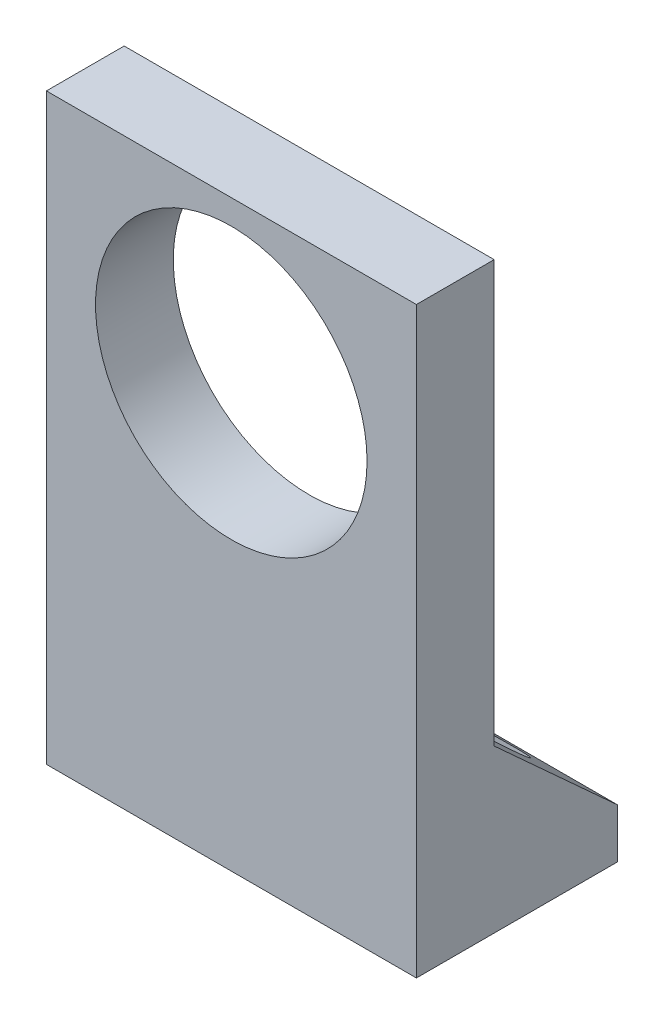
from build123d import *

# Parameters (mm, degrees)
SKETCH1_W            = 93
SKETCH1_H            = 100
BOSS_EXTRUDE2_DEPTH  = 10
SKETCH4_W            = 10.01
SKETCH4_H            = 15
BOSS_EXTRUDE4_DEPTH  = 24
SKETCH5_R            = 2
CUT_EXTRUDE1_DEPTH   = 50
SKETCH7_R            = 11
CUT_EXTRUDE3_DEPTH   = 50
SKETCH14_W           = 61.5
SKETCH14_H           = 42
CUT_EXTRUDE8_DEPTH   = 4
SKETCH19_R           = 11
CUT_EXTRUDE11_DEPTH  = 15
SKETCH20_R           = 2
CUT_EXTRUDE12_DEPTH  = 10
SKETCH21_W           = 40
SKETCH21_H           = 6
BOSS_EXTRUDE5_DEPTH  = 27
SKETCH22_W           = 40
SKETCH22_H           = 6.3
BOSS_EXTRUDE7_DEPTH  = 40
SKETCH23_R           = 8
CUT_EXTRUDE13_DEPTH  = 40
SKETCH24_W           = 118.277817783
SKETCH24_H           = 41.8
CUT_EXTRUDE14_DEPTH  = 40
SKETCH25_W           = 31.5
SKETCH25_H           = 23.2
CUT_EXTRUDE15_DEPTH  = 20
CUT_EXTRUDE18_DEPTH  = 3
SKETCH27_R           = 4.1
SKETCH27_R_2         = 4
CUT_EXTRUDE29_DEPTH  = 3
SKETCH28_W           = 29.5
SKETCH28_H           = 58.2
CUT_EXTRUDE30_DEPTH  = 23
SKETCH29_W           = 32
SKETCH29_H           = 4
CUT_EXTRUDE31_DEPTH  = 23
SKETCH31_W           = 32
SKETCH31_H           = 6
BOSS_EXTRUDE9_DEPTH  = 6.6
SKETCH32_W           = 32
SKETCH32_H           = 6
BOSS_EXTRUDE10_DEPTH = 10
SKETCH33_R           = 2
CUT_EXTRUDE32_DEPTH  = 10
BOSS_EXTRUDE11_START = -32
BOSS_EXTRUDE11_DEPTH = 32
SKETCH35_R           = 3.5
CUT_EXTRUDE33_DEPTH  = 10
SKETCH36_W           = 40
SKETCH36_H           = 6.3
BOSS_EXTRUDE12_DEPTH = 18.8
SKETCH37_W           = 40
SKETCH37_H           = 6
BOSS_EXTRUDE13_DEPTH = 16
SKETCH38_R           = 2
CUT_EXTRUDE34_DEPTH  = 16
BOSS_EXTRUDE14_DEPTH = 40
SKETCH40_R           = 3.5
CUT_EXTRUDE35_DEPTH  = 16
SKETCH41_W           = 16
SKETCH41_H           = 64.8
CUT_EXTRUDE36_DEPTH  = 76
SKETCH42_W           = 20.7
SKETCH42_H           = 6
CUT_EXTRUDE37_DEPTH  = 76
SKETCH43_W           = 10.32098901
SKETCH43_H           = 73.075116481
CUT_EXTRUDE38_DEPTH  = 30
SKETCH44_W           = 2
SKETCH44_H           = 70.783229749
CUT_EXTRUDE39_DEPTH  = 30
SKETCH45_W           = 27.67901099
SKETCH45_H           = 15
CUT_EXTRUDE40_DEPTH  = 30
SKETCH46_W           = 27.67901099
SKETCH46_H           = 2.54
CUT_EXTRUDE41_DEPTH  = 110
SKETCH47_R           = 11
CUT_EXTRUDE42_DEPTH  = 20
BOSS_EXTRUDE16_DEPTH = 2.3
CUT_EXTRUDE43_DEPTH  = 50
SKETCH51_W           = 29.97901099
SKETCH51_H           = 4
BOSS_EXTRUDE17_DEPTH = 10
SKETCH52_R           = 2
CUT_EXTRUDE44_DEPTH  = 10
BOSS_EXTRUDE18_DEPTH = 29.979011
SKETCH54_R           = 3.5
CUT_EXTRUDE45_DEPTH  = 10


with BuildPart() as part:
    # Sketch1 → Boss-Extrude2 (new body)
    with BuildSketch(Plane.XY):
        with Locations((-29.68705036, 14.928057554)):
            Rectangle(SKETCH1_W, SKETCH1_H)
    extrude(amount=BOSS_EXTRUDE2_DEPTH)

    # Sketch4 → Boss-Extrude4 (add)
    with BuildSketch(Plane(origin=(16.81294964, 0, 0), x_dir=(0, 0, -1), z_dir=(1, 0, 0))):
        with Locations((-4.995, -12.571942446)):
            Rectangle(SKETCH4_W, SKETCH4_H)
    extrude(amount=BOSS_EXTRUDE4_DEPTH)

    # Sketch5 → Cut-Extrude1 (cut)
    with BuildSketch(Plane(origin=(0, -5.071942446, 0), x_dir=(1, 0, 0), z_dir=(0, 1, 0))):
        with Locations(Location((26.81294964, -5, 0), (0, 0, 180))):
            Circle(SKETCH5_R)
    extrude(amount=-CUT_EXTRUDE1_DEPTH, mode=Mode.SUBTRACT)

    # Sketch7 → Cut-Extrude3 (cut)
    with BuildSketch(Plane(origin=(0, 0, 0), x_dir=(-1, 0, 0), z_dir=(0, 0, -1))):
        with Locations((24.18705036, 36.928057554)):
            Circle(SKETCH7_R)
    extrude(amount=-CUT_EXTRUDE3_DEPTH, mode=Mode.SUBTRACT)

    # Sketch14 → Cut-Extrude8 (cut)
    with BuildSketch(Plane.XY.offset(10)):
        with Locations((-13.93705036, 36.789132279)):
            Rectangle(SKETCH14_W, SKETCH14_H)
    extrude(amount=-CUT_EXTRUDE8_DEPTH, mode=Mode.SUBTRACT)

    # Sketch19 → Cut-Extrude11 (cut)
    with BuildSketch(Plane(origin=(0, 0, 0), x_dir=(-1, 0, 0), z_dir=(0, 0, -1))):
        with Locations((53.18705036, 36.928057554)):
            Circle(SKETCH19_R)
    extrude(amount=-CUT_EXTRUDE11_DEPTH, mode=Mode.SUBTRACT)

    # Sketch20 → Cut-Extrude12 (cut)
    with BuildSketch(Plane.XY.offset(6)):
        with Locations((-34.68705036, 50.928057554)):
            Circle(SKETCH20_R)
        with Locations((5.31294964, 50.928057554)):
            Circle(SKETCH20_R)
        with Locations((-34.68705036, 22.928057554)):
            Circle(SKETCH20_R)
        with Locations((5.31294964, 22.928057554)):
            Circle(SKETCH20_R)
    extrude(amount=-CUT_EXTRUDE12_DEPTH, mode=Mode.SUBTRACT)

    # Sketch21 → Boss-Extrude5 (add)
    with BuildSketch(Plane(origin=(0, 0, 0), x_dir=(-1, 0, 0), z_dir=(0, 0, -1))):
        with Locations((56.18705036, 61.928057554)):
            Rectangle(SKETCH21_W, SKETCH21_H)
    extrude(amount=BOSS_EXTRUDE5_DEPTH)

    # Sketch22 → Boss-Extrude7 (add)
    with BuildSketch(Plane.XZ.offset(-58.928057554)):
        with Locations((-56.18705036, -23.85)):
            Rectangle(SKETCH22_W, SKETCH22_H)
    extrude(amount=BOSS_EXTRUDE7_DEPTH)

    # Sketch23 → Cut-Extrude13 (cut)
    with BuildSketch(Plane.XY.offset(10)):
        with Locations((-53.18705036, 36.928057554)):
            Circle(SKETCH23_R)
    extrude(amount=-CUT_EXTRUDE13_DEPTH, mode=Mode.SUBTRACT)

    # Sketch24 → Cut-Extrude14 (cut)
    with BuildSketch(Plane.XY.offset(10)):
        with Locations((-17.048141468, -14.171942446)):
            Rectangle(SKETCH24_W, SKETCH24_H)
    extrude(amount=-CUT_EXTRUDE14_DEPTH, mode=Mode.SUBTRACT)

    # Sketch25 → Cut-Extrude15 (cut)
    with BuildSketch(Plane.XY.offset(10)):
        with Locations((-60.43705036, 18.328057554)):
            Rectangle(SKETCH25_W, SKETCH25_H)
    extrude(amount=-CUT_EXTRUDE15_DEPTH, mode=Mode.SUBTRACT)

    # Sketch26 → Cut-Extrude18 (cut)
    with BuildSketch(Plane.XY.offset(6)):
        with BuildLine():
            Line((14.30212304, 57.789132279), (6.863398886, 57.789132279))
            Line((6.863398886, 57.789132279), (6.863398886, 54.615347499))
            ThreePointArc((6.863398886, 54.615347499), (8.24773413, 53.645968516), (9.108195728, 52.191428892))
            Line((9.108195728, 52.191428892), (14.30212304, 52.191428892))
            Line((14.30212304, 52.191428892), (14.30212304, 57.789132279))
        make_face()
        with BuildLine():
            Line((6.863398886, 19.240767609), (6.863398886, 15.789132279))
            Line((6.863398886, 15.789132279), (14.30212304, 15.789132279))
            Line((14.30212304, 15.789132279), (14.30212304, 20.928057554))
            Line((14.30212304, 20.928057554), (8.777051255, 20.928057554))
            ThreePointArc((8.777051255, 20.928057554), (7.95835451, 19.927752057), (6.863398886, 19.240767609))
        make_face()
        with BuildLine():
            Line((-36.237499605, 57.789132279), (-44.68705036, 57.789132279))
            Line((-44.68705036, 57.789132279), (-44.68705036, 52.191428892))
            Line((-44.68705036, 52.191428892), (-38.482296447, 52.191428892))
            ThreePointArc((-38.482296447, 52.191428892), (-37.621834849, 53.645968516), (-36.237499605, 54.615347499))
            Line((-36.237499605, 54.615347499), (-36.237499605, 57.789132279))
        make_face()
        with BuildLine():
            Line((-44.68705036, 21.664686216), (-44.68705036, 15.789132279))
            Line((-44.68705036, 15.789132279), (-36.237499605, 15.789132279))
            Line((-36.237499605, 15.789132279), (-36.237499605, 19.240767609))
            ThreePointArc((-36.237499605, 19.240767609), (-37.621834849, 20.210146592), (-38.482296447, 21.664686216))
            Line((-38.482296447, 21.664686216), (-44.68705036, 21.664686216))
        make_face()
    extrude(amount=-CUT_EXTRUDE18_DEPTH, mode=Mode.SUBTRACT)

    # Sketch27 → Cut-Extrude29 (cut)
    with BuildSketch(Plane.XY.offset(6)):
        with Locations((5.31294964, 50.928057554)):
            Circle(SKETCH27_R)
        with Locations((5.31294964, 22.928057554)):
            Circle(SKETCH27_R_2)
        with Locations((-34.68705036, 50.928057554)):
            Circle(SKETCH27_R)
        with Locations((-34.68705036, 22.928057554)):
            Circle(SKETCH27_R)
    extrude(amount=-CUT_EXTRUDE29_DEPTH, mode=Mode.SUBTRACT)

    # Sketch28 → Cut-Extrude30 (cut)
    with BuildSketch(Plane(origin=(0, 0, 0), x_dir=(-1, 0, 0), z_dir=(0, 0, -1))):
        with Locations((-2.06294964, 35.828057554)):
            Rectangle(SKETCH28_W, SKETCH28_H)
    extrude(amount=-CUT_EXTRUDE30_DEPTH, mode=Mode.SUBTRACT)

    # Sketch29 → Cut-Extrude31 (cut)
    with BuildSketch(Plane(origin=(0, 15.789132279, 0), x_dir=(1, 0, 0), z_dir=(0, 1, 0))):
        with Locations((-28.68705036, -8)):
            Rectangle(SKETCH29_W, SKETCH29_H)
    extrude(amount=-CUT_EXTRUDE31_DEPTH, mode=Mode.SUBTRACT)

    # Sketch31 → Boss-Extrude9 (add)
    with BuildSketch(Plane.XZ.offset(-6.728057554)):
        with Locations((-28.68705036, 3)):
            Rectangle(SKETCH31_W, SKETCH31_H)
    extrude(amount=BOSS_EXTRUDE9_DEPTH)

    # Sketch32 → Boss-Extrude10 (add)
    with BuildSketch(Plane.XY.offset(6)):
        with Locations((-28.68705036, 3.128057554)):
            Rectangle(SKETCH32_W, SKETCH32_H)
    extrude(amount=BOSS_EXTRUDE10_DEPTH)

    # Sketch33 → Cut-Extrude32 (cut)
    with BuildSketch(Plane(origin=(0, 6.128057554, 0), x_dir=(1, 0, 0), z_dir=(0, 1, 0))):
        with Locations(Location((-37.68705036, -11, 0), (0, 0, 270))):
            Circle(SKETCH33_R)
        with Locations(Location((-19.68705036, -11, 0), (0, 0, 270))):
            Circle(SKETCH33_R)
    extrude(amount=-CUT_EXTRUDE32_DEPTH, mode=Mode.SUBTRACT)

    # Sketch34 → Boss-Extrude11 (add)
    with BuildSketch(Plane(origin=(-12.68705036, 0, 0), x_dir=(0, 0, -1), z_dir=(1, 0, 0)).offset(BOSS_EXTRUDE11_START)):
        Polygon((-16, 6.128057554), (-6, 6.128057554), (-6, 14.058360342), align=None)
    extrude(amount=BOSS_EXTRUDE11_DEPTH)

    # Sketch35 → Cut-Extrude33 (cut)
    with BuildSketch(Plane.XZ.offset(-6.128057554)):
        with Locations((-19.68705036, 11)):
            Circle(SKETCH35_R)
        with Locations((-37.68705036, 11)):
            Circle(SKETCH35_R)
    extrude(amount=-CUT_EXTRUDE33_DEPTH, mode=Mode.SUBTRACT)

    # Sketch36 → Boss-Extrude12 (add)
    with BuildSketch(Plane.XZ.offset(-18.928057554)):
        with Locations((-56.18705036, -23.85)):
            Rectangle(SKETCH36_W, SKETCH36_H)
    extrude(amount=BOSS_EXTRUDE12_DEPTH)

    # Sketch37 → Boss-Extrude13 (add)
    with BuildSketch(Plane.XY.offset(-20.7)):
        with Locations((-56.18705036, 3.128057554)):
            Rectangle(SKETCH37_W, SKETCH37_H)
    extrude(amount=BOSS_EXTRUDE13_DEPTH)

    # Sketch38 → Cut-Extrude34 (cut)
    with BuildSketch(Plane(origin=(0, 6.128057554, 0), x_dir=(1, 0, 0), z_dir=(0, 1, 0))):
        with Locations(Location((-58.18705036, 10.7, 0), (0, 0, 180))):
            Circle(SKETCH38_R)
        with Locations(Location((-45.18705036, 10.7, 0), (0, 0, 180))):
            Circle(SKETCH38_R)
    extrude(amount=-CUT_EXTRUDE34_DEPTH, mode=Mode.SUBTRACT)

    # Sketch39 → Boss-Extrude14 (add)
    with BuildSketch(Plane(origin=(-36.18705036, 0, 0), x_dir=(0, 0, -1), z_dir=(1, 0, 0))):
        Polygon((4.7, 6.128057554), (20.7, 18.878141719), (20.7, 6.128057554), align=None)
    extrude(amount=-BOSS_EXTRUDE14_DEPTH)

    # Sketch40 → Cut-Extrude35 (cut)
    with BuildSketch(Plane.XZ.offset(-6.128057554)):
        with Locations(Location((-45.18705036, -10.7, 0), (0, 0, 270))):
            Circle(SKETCH40_R)
        with Locations(Location((-58.18705036, -10.7, 0), (0, 0, 270))):
            Circle(SKETCH40_R)
    extrude(amount=-CUT_EXTRUDE35_DEPTH, mode=Mode.SUBTRACT)

    # Sketch41 → Cut-Extrude36 (cut)
    with BuildSketch(Plane(origin=(-12.68705036, 0, 0), x_dir=(0, 0, -1), z_dir=(1, 0, 0))):
        with Locations((-8, 32.528057554)):
            Rectangle(SKETCH41_W, SKETCH41_H)
    extrude(amount=-CUT_EXTRUDE36_DEPTH, mode=Mode.SUBTRACT)

    # Sketch42 → Cut-Extrude37 (cut)
    with BuildSketch(Plane(origin=(-36.18705036, 0, 0), x_dir=(0, 0, -1), z_dir=(1, 0, 0))):
        with Locations((10.35, 61.928057554)):
            Rectangle(SKETCH42_W, SKETCH42_H)
    extrude(amount=-CUT_EXTRUDE37_DEPTH, mode=Mode.SUBTRACT)

    # Sketch43 → Cut-Extrude38 (cut)
    with BuildSketch(Plane.XY.offset(-4.7)):
        with Locations((-71.026555855, 36.665615794)):
            Rectangle(SKETCH43_W, SKETCH43_H)
    extrude(amount=-CUT_EXTRUDE38_DEPTH, mode=Mode.SUBTRACT)

    # Sketch44 → Cut-Extrude39 (cut)
    with BuildSketch(Plane.XY.offset(-4.7)):
        with Locations((-37.18705036, 35.519672429)):
            Rectangle(SKETCH44_W, SKETCH44_H)
    extrude(amount=-CUT_EXTRUDE39_DEPTH, mode=Mode.SUBTRACT)

    # Sketch45 → Cut-Extrude40 (cut)
    with BuildSketch(Plane.XY.offset(-20.7)):
        with Locations((-52.026555855, 57.428057554)):
            Rectangle(SKETCH45_W, SKETCH45_H)
    extrude(amount=-CUT_EXTRUDE40_DEPTH, mode=Mode.SUBTRACT)

    # Sketch46 → Cut-Extrude41 (cut)
    with BuildSketch(Plane.XY.offset(-4.7)):
        with Locations((-52.026555855, 1.398057554)):
            Rectangle(SKETCH46_W, SKETCH46_H)
    extrude(amount=-CUT_EXTRUDE41_DEPTH, mode=Mode.SUBTRACT)

    # Sketch47 → Cut-Extrude42 (cut)
    with BuildSketch(Plane.XY.offset(-20.7)):
        with Locations((-53.18705036, 36.928057554)):
            Circle(SKETCH47_R)
    extrude(amount=-CUT_EXTRUDE42_DEPTH, mode=Mode.SUBTRACT)

    # Sketch48 → Boss-Extrude16 (add)
    with BuildSketch(Plane.ZY.offset(65.86606135)):
        Polygon((-27, 49.928057554), (-20.7, 49.928057554), (-20.7, 18.878141719), (-4.7, 6.128057554), (-4.7, 2.668057554), (-27, 2.668057554), align=None)
    extrude(amount=BOSS_EXTRUDE16_DEPTH)

    # Sketch49 → Cut-Extrude43 (cut)
    with BuildSketch(Plane.ZY.offset(68.16606135)):
        Polygon((-4.7, 2.668057554), (-4.7, 6.128057554), (-20.7, 18.878141719), (-20.7, 2.668057554), align=None)
    extrude(amount=-CUT_EXTRUDE43_DEPTH, mode=Mode.SUBTRACT)

    # Sketch51 → Boss-Extrude17 (add)
    with BuildSketch(Plane(origin=(0, 0, -27), x_dir=(-1, 0, 0), z_dir=(0, 0, -1))):
        with Locations((53.176555855, 4.668057554)):
            Rectangle(SKETCH51_W, SKETCH51_H)
    extrude(amount=BOSS_EXTRUDE17_DEPTH)

    # Sketch52 → Cut-Extrude44 (cut)
    with BuildSketch(Plane(origin=(0, 6.668057554, 0), x_dir=(1, 0, 0), z_dir=(0, 1, 0))):
        with Locations(Location((-45.18705036, 32, 0), (0, 0, 270))):
            Circle(SKETCH52_R)
        with Locations(Location((-61.16606135, 32, 0), (0, 0, 270))):
            Circle(SKETCH52_R)
    extrude(amount=-CUT_EXTRUDE44_DEPTH, mode=Mode.SUBTRACT)

    # Sketch53 → Boss-Extrude18 (add)
    with BuildSketch(Plane.ZY.offset(68.16606135)):
        Polygon((-37, 6.668057554), (-27, 6.668057554), (-27, 15.795425769), align=None)
    extrude(amount=-BOSS_EXTRUDE18_DEPTH)

    # Sketch54 → Cut-Extrude45 (cut)
    with BuildSketch(Plane.XZ.offset(-6.668057554)):
        with Locations(Location((-61.16606135, -32, 0), (0, 0, 270))):
            Circle(SKETCH54_R)
        with Locations(Location((-45.18705036, -32, 0), (0, 0, 270))):
            Circle(SKETCH54_R)
    extrude(amount=-CUT_EXTRUDE45_DEPTH, mode=Mode.SUBTRACT)


solid = part.part
